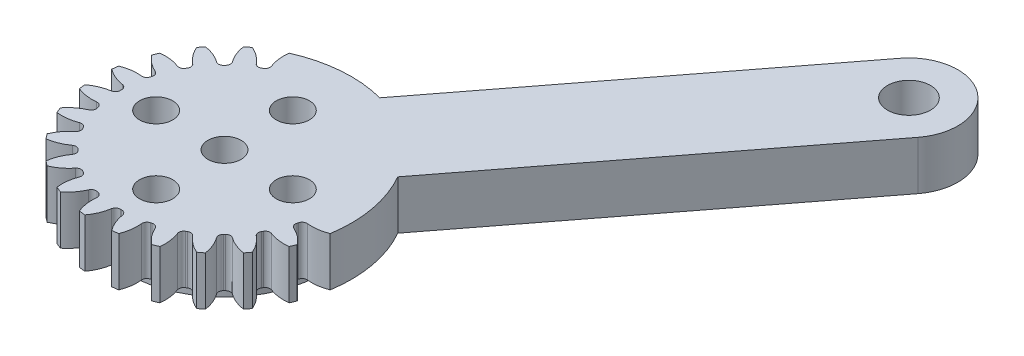
from build123d import *

# Parameters (mm, degrees)
SKETCH2_R                = 13
SKETCH2_R_2              = 1.7
BOSS_EXTRUDE1_DEPTH      = 5
CUT_EXTRUDE1_DEPTH       = 20.052558883
FILLET1_R                = 0.5
CIRPATTERN1_COUNT        = 24
FILLET1_OF_CIRPATTERN1_R = 0.5
SKETCH_4_R               = 1.7
CUT_EXTRUDE_1_DEPTH      = 19.952476005
EXTRUDE_START            = -5
SKETCH_5_R               = 2.2
EXTRUDE_1_DEPTH          = 5
SKETCH_6_R               = 10
SKETCH_6_R_2             = 1.7
EXTRUDE_2_DEPTH          = 1


with BuildPart() as part:
    # Sketch2 → Boss-Extrude1 (new body)
    with BuildSketch(Plane(origin=(0, 0, 0), x_dir=(1, 0, 0), z_dir=(0, 1, 0))):
        with Locations(Location((0, 0, 0), (0, 0, 270))):
            Circle(SKETCH2_R)
        with Locations(Location((0, 0, 0), (0, 0, 270))):
            Circle(SKETCH2_R_2, mode=Mode.SUBTRACT)
    extrude(amount=BOSS_EXTRUDE1_DEPTH)

    # Sketch3 → Cut-Extrude1 (cut, through all)
    with BuildSketch(Plane(origin=(0, 5, 0), x_dir=(1, 0, 0), z_dir=(0, 1, 0))):
        with BuildLine():
            ThreePointArc((0.527459192, 10.586868602), (0, 10.6), (-0.527459192, 10.586868602))
            ThreePointArc((-0.527459192, 10.586868602), (-0.776880215, 11.820955553), (-1.379068427, 12.926645747))
            ThreePointArc((-1.379068427, 12.926645747), (0, 13), (1.379068427, 12.926645747))
            ThreePointArc((1.379068427, 12.926645747), (0.776880215, 11.820955553), (0.527459192, 10.586868602))
        make_face()
    cut_extrude1 = extrude(amount=-CUT_EXTRUDE1_DEPTH, mode=Mode.SUBTRACT)

    # Fillet1
    fillet1_edges = [part.edges().sort_by_distance(p)[0] for p in [
        (-0.527459192, 2.5, -10.586868602),
        (0.527459192, 2.5, -10.586868602),
    ]]
    fillet(fillet1_edges, radius=FILLET1_R)

    # CirPattern1: Cut-Extrude1 ×24 about axis
    cirpattern1_axis = Axis((0, 0, 0), (0, 1, 0))
    for i in range(1, CIRPATTERN1_COUNT):
        add(cut_extrude1.rotate(cirpattern1_axis, i * 360 / CIRPATTERN1_COUNT), mode=Mode.SUBTRACT)

    # Fillet1 of CirPattern1
    fillet1_of_cirpattern1_edges = [part.edges().sort_by_distance(p)[0] for p in [
        (-3.249569678, 2.5, -10.089613318),
        (-2.230596767, 2.5, -10.362646287),
        (-5.750227361, 2.5, -8.90476756),
        (-4.836641242, 2.5, -9.432226752),
        (-7.859016551, 2.5, -7.113076609),
        (-7.113076609, 2.5, -7.859016551),
        (-9.432226752, 2.5, -4.836641242),
        (-8.90476756, 2.5, -5.750227361),
        (-10.362646287, 2.5, -2.230596767),
        (-10.089613318, 2.5, -3.249569678),
        (-10.586868602, 2.5, 0.527459192),
        (-10.586868602, 2.5, -0.527459192),
        (-10.089613318, 2.5, 3.249569678),
        (-10.362646287, 2.5, 2.230596767),
        (-8.90476756, 2.5, 5.750227361),
        (-9.432226752, 2.5, 4.836641242),
        (-7.113076609, 2.5, 7.859016551),
        (-7.859016551, 2.5, 7.113076609),
        (-4.836641242, 2.5, 9.432226752),
        (-5.750227361, 2.5, 8.90476756),
        (-2.230596767, 2.5, 10.362646287),
        (-3.249569678, 2.5, 10.089613318),
        (0.527459192, 2.5, 10.586868602),
        (-0.527459192, 2.5, 10.586868602),
        (3.249569678, 2.5, 10.089613318),
        (2.230596767, 2.5, 10.362646287),
        (5.750227361, 2.5, 8.90476756),
        (4.836641242, 2.5, 9.432226752),
        (7.859016551, 2.5, 7.113076609),
        (7.113076609, 2.5, 7.859016551),
        (9.432226752, 2.5, 4.836641242),
        (8.90476756, 2.5, 5.750227361),
        (10.362646287, 2.5, 2.230596767),
        (10.089613318, 2.5, 3.249569678),
        (10.586868602, 2.5, -0.527459192),
        (10.586868602, 2.5, 0.527459192),
        (10.089613318, 2.5, -3.249569678),
        (10.362646287, 2.5, -2.230596767),
        (8.90476756, 2.5, -5.750227361),
        (9.432226752, 2.5, -4.836641242),
        (7.113076609, 2.5, -7.859016551),
        (7.859016551, 2.5, -7.113076609),
        (4.836641242, 2.5, -9.432226752),
        (5.750227361, 2.5, -8.90476756),
        (2.230596767, 2.5, -10.362646287),
        (3.249569678, 2.5, -10.089613318),
    ]]
    fillet(fillet1_of_cirpattern1_edges, radius=FILLET1_OF_CIRPATTERN1_R)

    # 草图4 → 切除-拉伸1 (cut, through all)
    with BuildSketch(Plane(origin=(0, 5, 0), x_dir=(1, 0, 0), z_dir=(0, 1, 0))):
        with Locations(Location((-7, 0, 0), (0, 0, 270))):
            Circle(SKETCH_4_R)
        with Locations(Location((0, 7, 0), (0, 0, 270))):
            Circle(SKETCH_4_R)
        with Locations(Location((7, 0, 0), (0, 0, 270))):
            Circle(SKETCH_4_R)
        with Locations(Location((0, -7, 0), (0, 0, 270))):
            Circle(SKETCH_4_R)
    extrude(amount=-CUT_EXTRUDE_1_DEPTH, mode=Mode.SUBTRACT)

    # 草图5 → 凸台-拉伸1 (add)
    # profile 1 of 3: a face of its own
    with BuildSketch(Plane(origin=(0, 5, 0), x_dir=(1, 0, 0), z_dir=(0, 1, 0)).offset(EXTRUDE_START)):
        with BuildLine():
            ThreePointArc((-3.61022828, 8.715862078), (-1.39486951, 9.330291477), (0.903324731, 9.390633867))
            Line((0.903324731, 9.390633867), (3.338370447, 12.564047229))
            ThreePointArc((3.338370447, 12.564047229), (-0.863809344, 12.971269538), (-4.974884621, 12.010433923))
            Line((-4.974884621, 12.010433923), (-3.61022828, 8.715862078))
        make_face()
    # profile 2 of 3: a face of its own
    with BuildSketch(Plane(origin=(0, 5, 0), x_dir=(1, 0, 0), z_dir=(0, 1, 0)).offset(EXTRUDE_START)):
        with BuildLine():
            Line((8.836858134, 3.303019577), (34.404838152, 36.62385987))
            ThreePointArc((34.404838152, 36.62385987), (33.481878595, 43.634433716), (26.471304749, 42.71147416))
            Line((26.471304749, 42.71147416), (0.903324731, 9.390633867))
            Line((0.903324731, 9.390633867), (8.836858134, 3.303019577))
        make_face()
        with Locations(Location((30.43807145, 39.667667015, 0), (0, 0, 270))):
            Circle(SKETCH_5_R, mode=Mode.SUBTRACT)
    # profile 3 of 3: a face of its own
    with BuildSketch(Plane(origin=(0, 5, 0), x_dir=(1, 0, 0), z_dir=(0, 1, 0)).offset(EXTRUDE_START)):
        with BuildLine():
            Line((11.27190385, 6.476432938), (8.836858134, 3.303019577))
            ThreePointArc((8.836858134, 3.303019577), (9.373388299, 1.067516647), (9.353272116, -1.231381635))
            Line((9.353272116, -1.231381635), (12.888783198, -1.696840499))
            ThreePointArc((12.888783198, -1.696840499), (12.752854556, 2.522835841), (11.27190385, 6.476432938))
        make_face()
    extrude(amount=EXTRUDE_1_DEPTH)

    # 草图6 → 凸台-拉伸2 (add)
    with BuildSketch(Plane(origin=(0, 0, 0), x_dir=(-1, 0, 0), z_dir=(0, -1, 0))):
        with Locations(Location((0, 0, 0), (0, 0, 270))):
            Circle(SKETCH_6_R)
        with Locations(Location((0, 0, 0), (0, 0, 90))):
            Circle(SKETCH_6_R_2, mode=Mode.SUBTRACT)
        with Locations(Location((0, 7, 0), (0, 0, 270))):
            Circle(SKETCH_6_R_2, mode=Mode.SUBTRACT)
        with Locations(Location((-7, 0, 0), (0, 0, 270))):
            Circle(SKETCH_6_R_2, mode=Mode.SUBTRACT)
        with Locations(Location((0, -7, 0), (0, 0, 270))):
            Circle(SKETCH_6_R_2, mode=Mode.SUBTRACT)
        with Locations(Location((7, 0, 0), (0, 0, 270))):
            Circle(SKETCH_6_R_2, mode=Mode.SUBTRACT)
    extrude(amount=EXTRUDE_2_DEPTH)


solid = part.part
